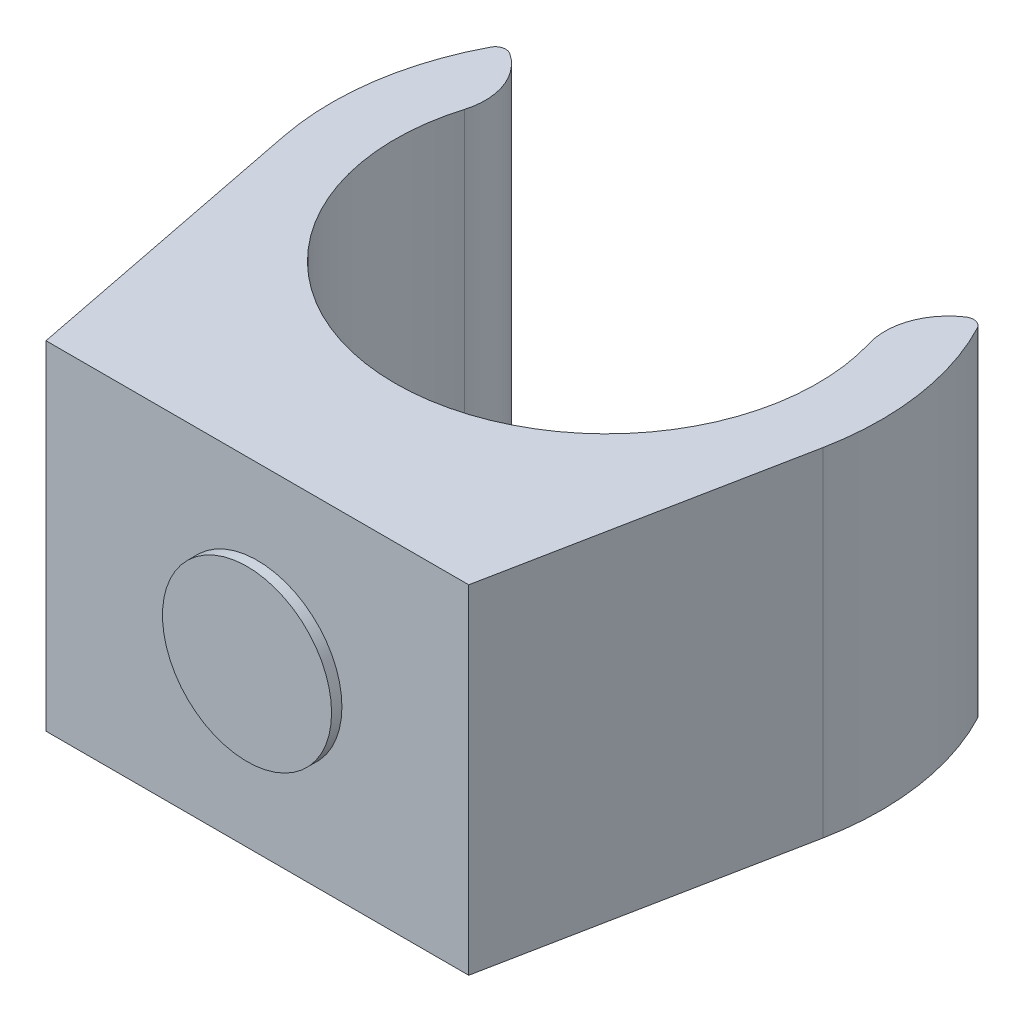
from build123d import *

# Parameters (mm, degrees)
EXTRUIR1_DEPTH      = 16
EXTRUIR2_REACH      = 43.372
EXTRUIR2_END_RADIUS = 13
EXTRUIR2_START      = 17
CROQUIS2_R          = 4
REDONDEO1_R         = 3
REDONDEO2_R         = 0.5
EXTRUIR3_START      = -16
EXTRUIR3_DEPTH      = 16


with BuildPart() as part:
    # Croquis1 → Extruir1 (new body)
    with BuildSketch(Plane(origin=(0, 0, 0), x_dir=(1, 0, 0), z_dir=(0, 1, 0))):
        with BuildLine():
            Line((11.258330249, 6.5), (8.660254038, 5))
            ThreePointArc((8.660254038, 5), (0, -10), (-8.660254038, 5))
            Line((-8.660254038, 5), (-11.258330249, 6.5))
            ThreePointArc((-11.258330249, 6.5), (0, -13), (11.258330249, 6.5))
        make_face()
    extrude(amount=EXTRUIR1_DEPTH)

    # Extruir2: up to this cylinder (the profile starts outside it)
    extruir2_end = Plane(origin=(0, 8, 0), z_dir=(0, -1, 0)) * Cylinder(EXTRUIR2_END_RADIUS, 113.744, mode=Mode.PRIVATE)
    # Croquis2 → Extruir2 (add, up to the surface)
    with BuildSketch(Plane.XY.offset(EXTRUIR2_START), mode=Mode.PRIVATE) as extruir2_sk1:
        with Locations((0, 8)):
            Circle(CROQUIS2_R)
    extruir2_tool1 = extrude(extruir2_sk1.sketch, amount=-EXTRUIR2_REACH, mode=Mode.PRIVATE) - extruir2_end
    add(extruir2_tool1.solids().sort_by_distance((0, 8, 17))[0])

    # Redondeo1
    redondeo1_edges = [part.edges().sort_by_distance(p)[0] for p in [
        (8.660254038, 8, -5),
        (-8.660254038, 8, -5),
    ]]
    fillet(redondeo1_edges, radius=REDONDEO1_R)

    # Redondeo2
    redondeo2_edges = [part.edges().sort_by_distance(p)[0] for p in [
        (11.258330249, 8, -6.5),
        (-11.258330249, 8, -6.5),
    ]]
    fillet(redondeo2_edges, radius=REDONDEO2_R)

    # Croquis3 → Extruir3 (add)
    with BuildSketch(Plane(origin=(0, 16, 0), x_dir=(1, 0, 0), z_dir=(0, 1, 0)).offset(EXTRUIR3_START)):
        with BuildLine():
            Line((-12.755317519, -2.510353559), (-10, -16.510353559))
            Line((-10, -16.510353559), (10, -16.510353559))
            Line((10, -16.510353559), (12.755317519, -2.510353559))
            Line((12.755317519, -2.510353559), (9.679779182, -2.510353559))
            ThreePointArc((9.679779182, -2.510353559), (0, -10), (-9.679779182, -2.510353559))
            Line((-9.679779182, -2.510353559), (-12.755317519, -2.510353559))
        make_face()
    extrude(amount=EXTRUIR3_DEPTH)


solid = part.part
